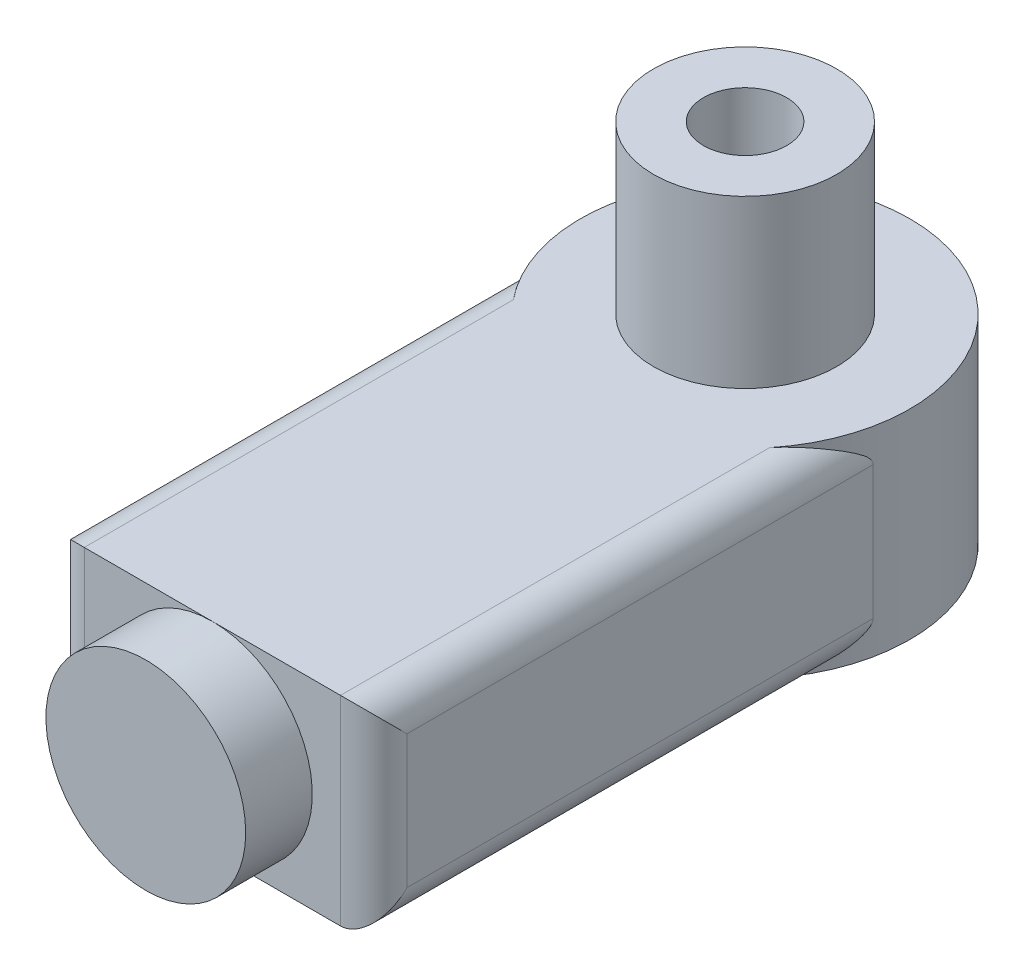
from build123d import *

# Parameters (mm, degrees)
EXTRUDE_1_DEPTH = 6
SKETCH_2_R      = 2.75
SKETCH_2_R_2    = 1.25
EXTRUDE_2_DEPTH = 5
SKETCH_3_R      = 3
EXTRUDE_3_DEPTH = 2
FILLET_1_R      = 1


with BuildPart() as part:
    # 草图1 → 凸台-拉伸1 (new body)
    with BuildSketch(Plane(origin=(0, 0, 0), x_dir=(1, 0, 0), z_dir=(0, 1, 0))):
        with BuildLine():
            Line((-4.847365484, -1), (-4.847365484, -16))
            Line((-4.847365484, -16), (4.847365484, -16))
            Line((4.847365484, -16), (4.847365484, -1))
            ThreePointArc((4.847365484, -1), (0, 4.949439578), (-4.847365484, -1))
        make_face()
    extrude(amount=EXTRUDE_1_DEPTH)

    # 草图3 → 凸台-拉伸3 (add)
    with BuildSketch(Plane.XY.offset(16)):
        with Locations(Location((0, 3, 0), (0, 0, 270))):
            Circle(SKETCH_3_R)
    extrude(amount=EXTRUDE_3_DEPTH)

    # 圆角1
    fillet_1_edges = [part.edges().sort_by_distance(p)[0] for p in [
        (-4.847365484, 6, 8.5),
        (4.847365484, 6, 8.5),
        (-4.847365484, 0, 8.5),
        (4.847365484, 0, 8.5),
        (-4.847365484, 3, 16),
        (4.847365484, 3, 16),
    ]]
    fillet(fillet_1_edges, radius=FILLET_1_R)


with BuildPart() as body_2:
    # 草图2 → 凸台-拉伸2 (new body)
    with BuildSketch(Plane(origin=(0, 6, 0), x_dir=(1, 0, 0), z_dir=(0, 1, 0))):
        with Locations(Location((0, 0, 0), (0, 0, 270))):
            Circle(SKETCH_2_R)
        with Locations(Location((0, 0, 0), (0, 0, 270))):
            Circle(SKETCH_2_R_2, mode=Mode.SUBTRACT)
    extrude(amount=EXTRUDE_2_DEPTH)


solid = Compound([part.part, body_2.part])
